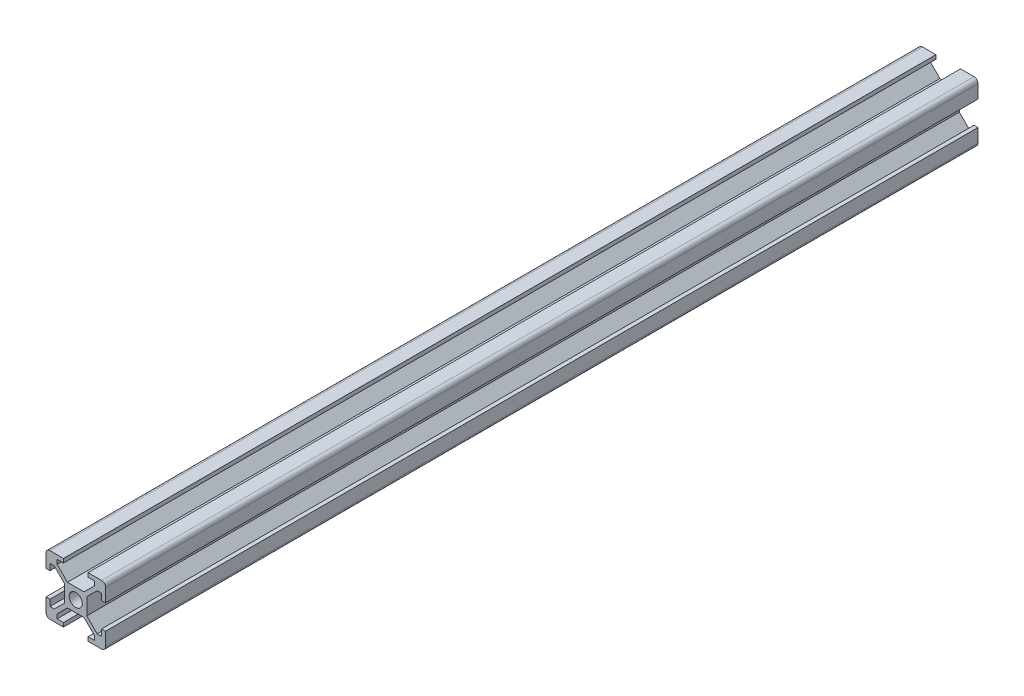
from build123d import *

# Parameters (mm, degrees)
SKETCH_2_R      = 1.65
EXTRUDE_1_DEPTH = 110


with BuildPart() as part:
    # 草图2 → 凸台-拉伸1 (new, symmetric)
    with BuildSketch(Plane.XY):
        with BuildLine():
            Line((-2.092893219, -2.8), (-4.7, -5.407106781))
            Line((-4.7, -5.407106781), (-4.7, -6.5))
            Line((-4.7, -6.5), (-3.1, -6.5))
            Line((-3.1, -6.5), (-3.1, -7.5))
            Line((-3.1, -7.5), (-6.5, -7.5))
            ThreePointArc((-6.5, -7.5), (-7.207106781, -7.207106781), (-7.5, -6.5))
            Line((-7.5, -6.5), (-7.5, -3.1))
            Line((-7.5, -3.1), (-6.5, -3.1))
            Line((-6.5, -3.1), (-6.5, -4.7))
            Line((-6.5, -4.7), (-5.407106781, -4.7))
            Line((-5.407106781, -4.7), (-2.8, -2.092893219))
            Line((-2.8, -2.092893219), (-2.8, 2.092893219))
            Line((-2.8, 2.092893219), (-5.407106781, 4.7))
            Line((-5.407106781, 4.7), (-6.5, 4.7))
            Line((-6.5, 4.7), (-6.5, 3.1))
            Line((-6.5, 3.1), (-7.5, 3.1))
            Line((-7.5, 3.1), (-7.5, 6.5))
            ThreePointArc((-7.5, 6.5), (-7.207106781, 7.207106781), (-6.5, 7.5))
            Line((-6.5, 7.5), (-3.1, 7.5))
            Line((-3.1, 7.5), (-3.1, 6.5))
            Line((-3.1, 6.5), (-4.7, 6.5))
            Line((-4.7, 6.5), (-4.7, 5.407106781))
            Line((-4.7, 5.407106781), (-2.092893219, 2.8))
            Line((-2.092893219, 2.8), (2.092893219, 2.8))
            Line((2.092893219, 2.8), (4.7, 5.407106781))
            Line((4.7, 5.407106781), (4.7, 6.5))
            Line((4.7, 6.5), (3.1, 6.5))
            Line((3.1, 6.5), (3.1, 7.5))
            Line((3.1, 7.5), (6.5, 7.5))
            ThreePointArc((6.5, 7.5), (7.207106781, 7.207106781), (7.5, 6.5))
            Line((7.5, 6.5), (7.5, 3.1))
            Line((7.5, 3.1), (6.5, 3.1))
            Line((6.5, 3.1), (6.5, 4.7))
            Line((6.5, 4.7), (5.407106781, 4.7))
            Line((5.407106781, 4.7), (2.8, 2.092893219))
            Line((2.8, 2.092893219), (2.8, -2.092893219))
            Line((2.8, -2.092893219), (5.407106781, -4.7))
            Line((5.407106781, -4.7), (6.5, -4.7))
            Line((6.5, -4.7), (6.5, -3.1))
            Line((6.5, -3.1), (7.5, -3.1))
            Line((7.5, -3.1), (7.5, -6.5))
            ThreePointArc((7.5, -6.5), (7.207106781, -7.207106781), (6.5, -7.5))
            Line((6.5, -7.5), (3.1, -7.5))
            Line((3.1, -7.5), (3.1, -6.5))
            Line((3.1, -6.5), (4.7, -6.5))
            Line((4.7, -6.5), (4.7, -5.407106781))
            Line((4.7, -5.407106781), (2.092893219, -2.8))
            Line((2.092893219, -2.8), (-2.092893219, -2.8))
        make_face()
        Circle(SKETCH_2_R, mode=Mode.SUBTRACT)
    extrude(amount=EXTRUDE_1_DEPTH, both=True)


solid = part.part
